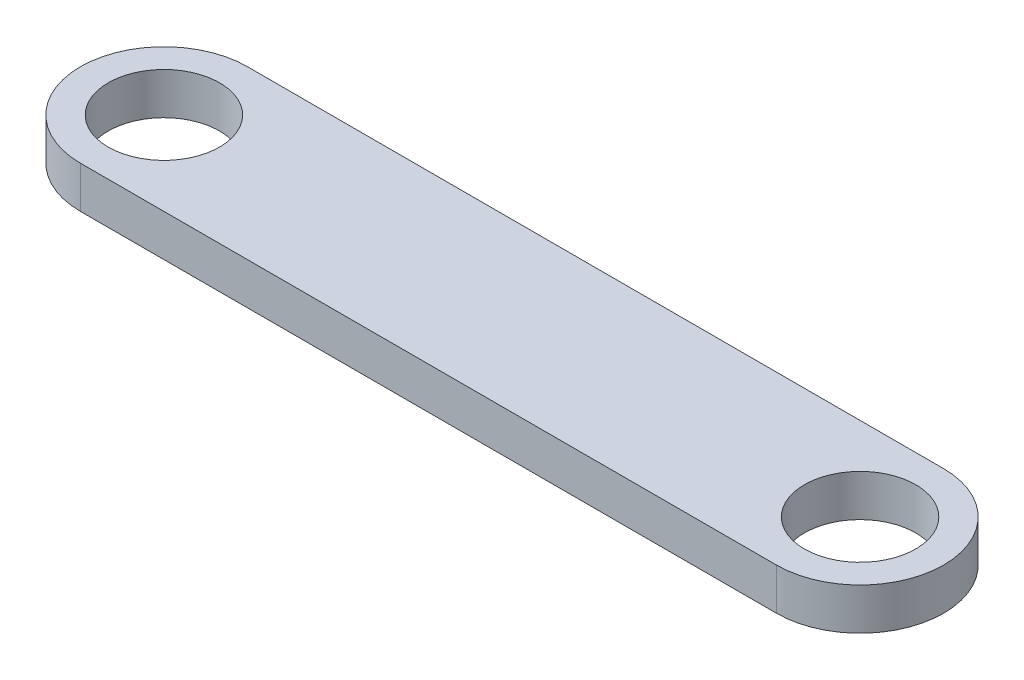
from build123d import *

# Parameters (mm, degrees)
SKETCH1_R           = 4
BOSS_EXTRUDE1_DEPTH = 3


with BuildPart() as part:
    # Sketch1 → Boss-Extrude1 (new body)
    with BuildSketch(Plane(origin=(0, 0, 0), x_dir=(1, 0, 0), z_dir=(0, 1, 0))):
        with BuildLine():
            Line((-40.12463695, 6.12463695), (9.87536305, 6.12463695))
            ThreePointArc((9.87536305, 6.12463695), (15.87536305, 0.12463695), (9.87536305, -5.87536305))
            Line((9.87536305, -5.87536305), (-40.12463695, -5.87536305))
            ThreePointArc((-40.12463695, -5.87536305), (-46.12463695, 0.12463695), (-40.12463695, 6.12463695))
        make_face()
        with Locations(Location((-40.12463695, 0.12463695, 0), (0, 0, 270))):
            Circle(SKETCH1_R, mode=Mode.SUBTRACT)
        with Locations(Location((9.87536305, 0.12463695, 0), (0, 0, 270))):
            Circle(SKETCH1_R, mode=Mode.SUBTRACT)
    extrude(amount=BOSS_EXTRUDE1_DEPTH)


solid = part.part
